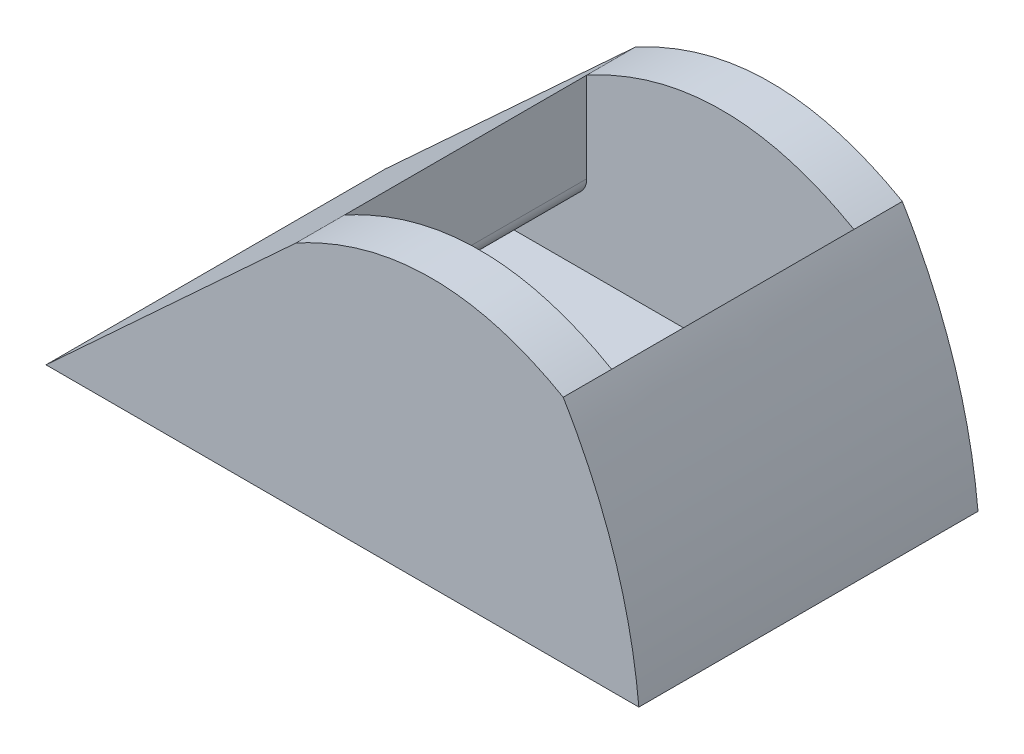
from build123d import *

# Parameters (mm, degrees)
BOSS_EXTRUDE1_DEPTH      = 350
BOSS_EXTRUDE1_DEPTH_BACK = 350
CUT_EXTRUDE1_DEPTH       = 250
CUT_EXTRUDE1_DEPTH_BACK  = 250


with BuildPart() as part:
    # Sketch6 → Boss-Extrude1 (new, two sides: drawn at the far end of the back side and taken through both)
    with BuildSketch(Plane.XY.offset(-BOSS_EXTRUDE1_DEPTH_BACK)):
        with BuildLine():
            Line((971.509879636, -124.075068782), (-252.203431313, -124.075068782))
            Line((-252.203431313, -124.075068782), (263.900031848, 351.768416645))
            add(Edge.make_bspline(
                [(263.900031848, 351.768416645), (546.111311767, 505.694887208), (815.348837324, 351.768416645)],
                knots=[0, 0, 0, 1, 1, 1], degree=2))
            add(Edge.make_bspline(
                [(815.348837324, 351.768416645), (947.510823837, 130.321252054), (971.509879636, -124.075068782)],
                knots=[0, 0, 0, 1, 1, 1], degree=2))
        make_face()
    extrude(amount=BOSS_EXTRUDE1_DEPTH + BOSS_EXTRUDE1_DEPTH_BACK)

    # Sketch5 → Cut-Extrude1 (cut, two sides: drawn at the far end of the back side and taken through both)
    with BuildSketch(Plane.XY.offset(-CUT_EXTRUDE1_DEPTH_BACK)):
        with BuildLine():
            Line((0, 0), (672.171335821, 0))
            ThreePointArc((672.171335821, 0), (695.015340994, 7.164783727), (709.67572834, 26.092428616))
            Line((709.67572834, 26.092428616), (818.005303321, 318.223584322))
            ThreePointArc((818.005303321, 318.223584322), (820.376071762, 335.288930001), (815.348837324, 351.768416645))
            add(Edge.make_bspline(
                [(263.900031848, 351.768416645), (546.111311767, 505.694887208), (815.348837324, 351.768416645)],
                knots=[0, 0, 0, 1, 1, 1], degree=2))
            Line((263.900031848, 351.768416645), (263.900031848, 166.522987154))
            ThreePointArc((263.900031848, 166.522987154), (258.258035835, 146.04061517), (242.923653745, 131.336316241))
            Line((242.923653745, 131.336316241), (0, 0))
        make_face()
    extrude(amount=CUT_EXTRUDE1_DEPTH + CUT_EXTRUDE1_DEPTH_BACK, mode=Mode.SUBTRACT)


solid = part.part
